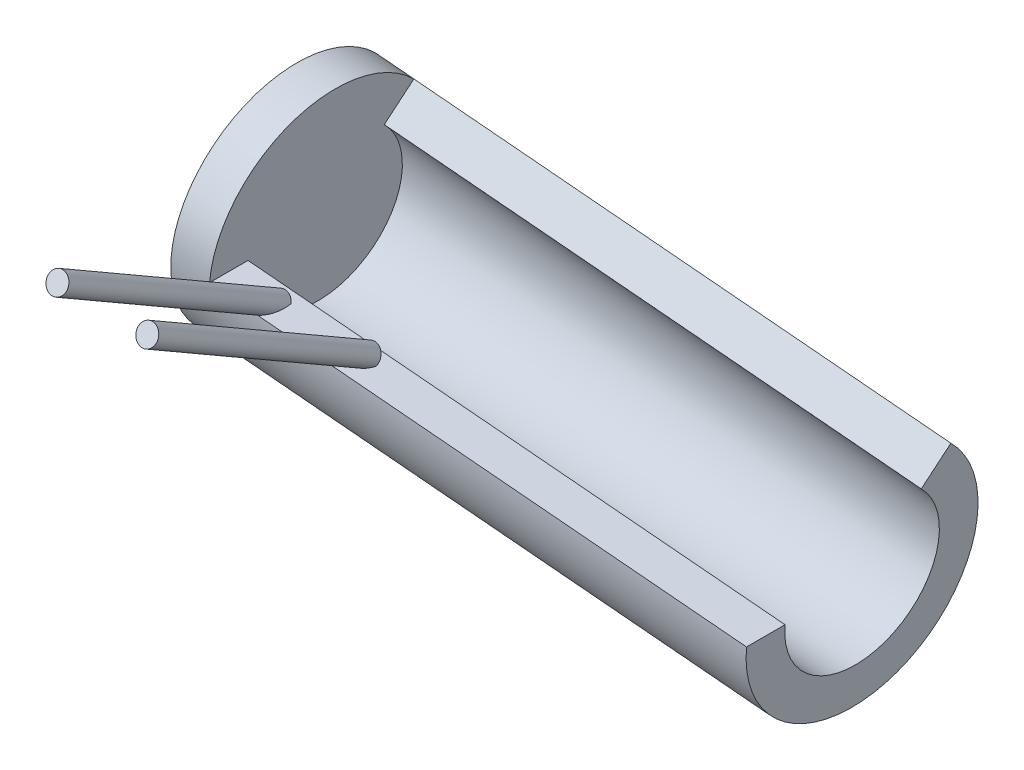
from build123d import *

# Parameters (mm, degrees)
SKETCH2_R                = 4
BOSS_EXTRUDE1_DEPTH      = 100
BOSS_EXTRUDE1_2_DEPTH    = 100
BOSS_EXTRUDE3_DEPTH      = 50
BOSS_EXTRUDE3_DEPTH_BACK = 175
BOSS_EXTRUDE4_START      = -15
SKETCH5_R                = 45.011707972
BOSS_EXTRUDE4_DEPTH      = 15
SKETCH8_R                = 30.011707972
CUT_EXTRUDE1_DEPTH       = 210


with BuildPart() as part:
    # Sketch2 → Boss-Extrude1 (new body)
    with BuildSketch(Plane(origin=(0, 0, 0), x_dir=(-1, 0, 0), z_dir=(0, 0.499999999999998, -0.8660254037844398))):
        with Locations(Location((-17.5, 0, 0), (0, 0, 90))):
            Circle(SKETCH2_R)
    boss_extrude1 = extrude(amount=BOSS_EXTRUDE1_DEPTH)



with BuildPart() as body_2:
    # Sketch2 → Boss-Extrude1 2 (new body)
    with BuildSketch(Plane(origin=(0, 0, 0), x_dir=(-1, 0, 0), z_dir=(0, 0.499999999999998, -0.8660254037844398))):
        with Locations(Location((17.5, 0, 0), (0, 0, 90))):
            Circle(SKETCH2_R)
    boss_extrude1_2 = extrude(amount=BOSS_EXTRUDE1_2_DEPTH)


with BuildPart() as part_1:
    add(part.part)

    add(body_2.part)  # Boss-Extrude3 merges body 2
    # Sketch4 → Boss-Extrude3 (add, two sides: drawn at the far end of the back side and taken through both)
    with BuildSketch(Plane(origin=(0, 0, 0), x_dir=(0, 0, 1), z_dir=(-0.9961946980917461, 0.08715574274765156, 0)).offset(-BOSS_EXTRUDE3_DEPTH_BACK)):
        with BuildLine():
            Line((80.028265546, 0), (65.028265546, 0))
            ThreePointArc((65.028265546, 0), (23.531574155, -27.727202731), (13.795075351, 21.221482222))
            Line((13.795075351, 21.221482222), (3.188473633, 31.82808394))
            ThreePointArc((3.188473633, 31.82808394), (17.79132267, -41.585395719), (80.028265546, 0))
        make_face()
    extrude(amount=BOSS_EXTRUDE3_DEPTH + BOSS_EXTRUDE3_DEPTH_BACK)

    # Sketch5 → Boss-Extrude4 (add)
    with BuildSketch(Plane(origin=(-49.809734905, 4.357787137, 0), x_dir=(0, 0, 1), z_dir=(-0.9961946980917462, 0.08715574274765156, 0)).offset(BOSS_EXTRUDE4_START)):
        with Locations(Location((35.016557573, 0, 0), (0, 0, 135))):
            Circle(SKETCH5_R)
    extrude(amount=BOSS_EXTRUDE4_DEPTH)

    # Mirror2: Boss-Extrude1, Boss-Extrude1 2 across plane
    add(boss_extrude1.mirror(Plane(origin=(0, 0, 35.016557573), x_dir=(1, 0, 0), z_dir=(0, 0, -1))))
    add(boss_extrude1_2.mirror(Plane(origin=(0, 0, 35.016557573), x_dir=(1, 0, 0), z_dir=(0, 0, -1))))

    # Sketch8 → Cut-Extrude1 (cut)
    with BuildSketch(Plane(origin=(174.334072166, -15.252254981, 0), x_dir=(0, 0, -1), z_dir=(0.9961946980917462, -0.08715574274765156, 0))):
        with Locations((-35.016557573, 0)):
            Circle(SKETCH8_R)
        with BuildLine():
            Line((-80.028265546, 0), (-208.366954173, 0))
            ThreePointArc((-208.366954173, 0), (87.560683384, -122.577240957), (-35.016557573, 173.3503966))
            Line((-35.016557573, 173.3503966), (-35.016557573, 45.011707972))
            ThreePointArc((-35.016557573, 45.011707972), (-3.188473633, -31.82808394), (-80.028265546, 0))
        make_face()
    extrude(amount=-CUT_EXTRUDE1_DEPTH, mode=Mode.SUBTRACT)


solid = part_1.part
